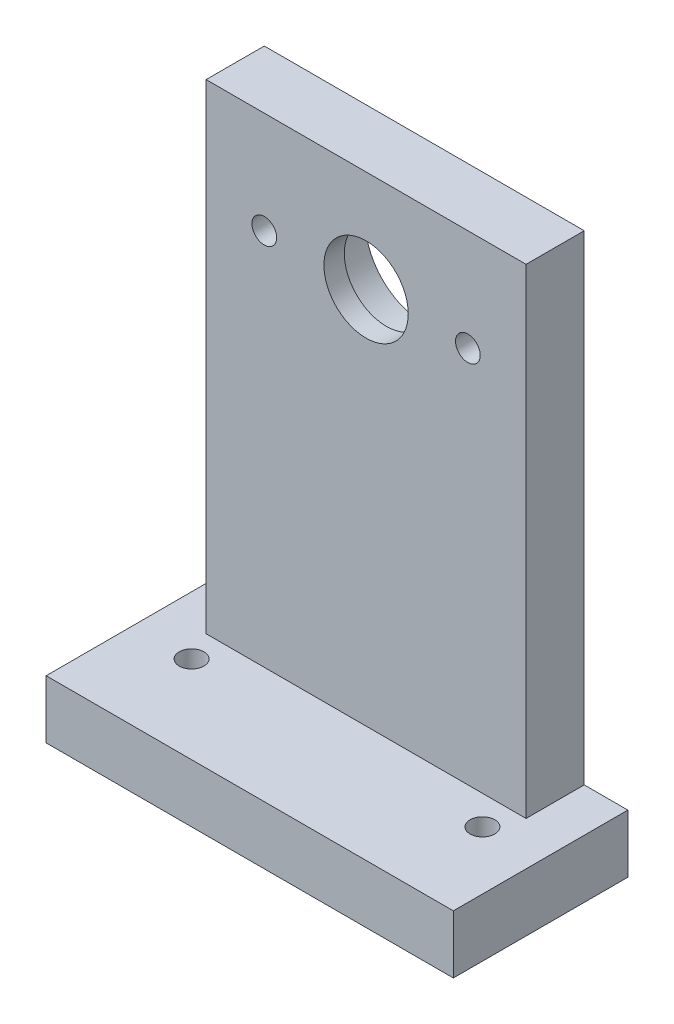
from build123d import *

# Parameters (mm, degrees)
SKETCH_1_W                                   = 56
SKETCH_1_H                                   = 8
FOOT_56X24X8_DEPTH                           = 24
SKETCH_2_W                                   = 44
SKETCH_2_H                                   = 74
TOWER_PIVOT_HEIGHT60_DEPTH                   = 8
SHAFT_ACCESS_AND_RETAINER_M3_DEPTH           = 83.680106434
SHAFT_ACCESS_AND_RETAINER_M3_DEPTH_BACK      = 83.680106434
SKETCH_3_R                                   = 5.8
SKETCH_3_R_2                                 = 1.7
SKETCH_4_R                                   = 8.1
F_625ZZ_POCKET_D16P2_DEPTH5P2_TEST_FIT_DEPTH = 5.2
FOOT_M3_THROUGH_DEPTH                        = 83.680106434
FOOT_M3_THROUGH_DEPTH_BACK                   = 83.680106434
SKETCH_5_R                                   = 1.7


with BuildPart() as part:
    # 草图1 → Foot_56x24x8 (new body)
    with BuildSketch(Plane.XY):
        with Locations((0, 4)):
            Rectangle(SKETCH_1_W, SKETCH_1_H)
    extrude(amount=FOOT_56X24X8_DEPTH)

    # 草图2 → Tower_pivot_height60 (add)
    with BuildSketch(Plane.XY):
        with Locations((0, 37)):
            Rectangle(SKETCH_2_W, SKETCH_2_H)
    extrude(amount=TOWER_PIVOT_HEIGHT60_DEPTH)

    # 草图3 → Shaft_access_and_retainer_M3 (cut, two sides: drawn at the far end of the back side and taken through both)
    with BuildSketch(Plane.XY.offset(-SHAFT_ACCESS_AND_RETAINER_M3_DEPTH_BACK)):
        with Locations((0, 60)):
            Circle(SKETCH_3_R)
        with Locations((-14, 60)):
            Circle(SKETCH_3_R_2)
        with Locations((14, 60)):
            Circle(SKETCH_3_R_2)
    extrude(amount=SHAFT_ACCESS_AND_RETAINER_M3_DEPTH + SHAFT_ACCESS_AND_RETAINER_M3_DEPTH_BACK, mode=Mode.SUBTRACT)

    # 草图4 → 625ZZ_pocket_D16p2_depth5p2_TEST_FIT (cut)
    with BuildSketch(Plane.XY):
        with Locations((0, 60)):
            Circle(SKETCH_4_R)
    extrude(amount=F_625ZZ_POCKET_D16P2_DEPTH5P2_TEST_FIT_DEPTH, mode=Mode.SUBTRACT)

    # 草图5 → Foot_M3_through (cut, two sides: drawn at the far end of the back side and taken through both)
    with BuildSketch(Plane(origin=(0, 0, 0), x_dir=(1, 0, 0), z_dir=(0, 1, 0)).offset(-FOOT_M3_THROUGH_DEPTH_BACK)):
        with Locations(Location((-20, -12, 0), (0, 0, 270))):
            Circle(SKETCH_5_R)
        with Locations(Location((20, -12, 0), (0, 0, 270))):
            Circle(SKETCH_5_R)
    extrude(amount=FOOT_M3_THROUGH_DEPTH + FOOT_M3_THROUGH_DEPTH_BACK, mode=Mode.SUBTRACT)


solid = part.part
